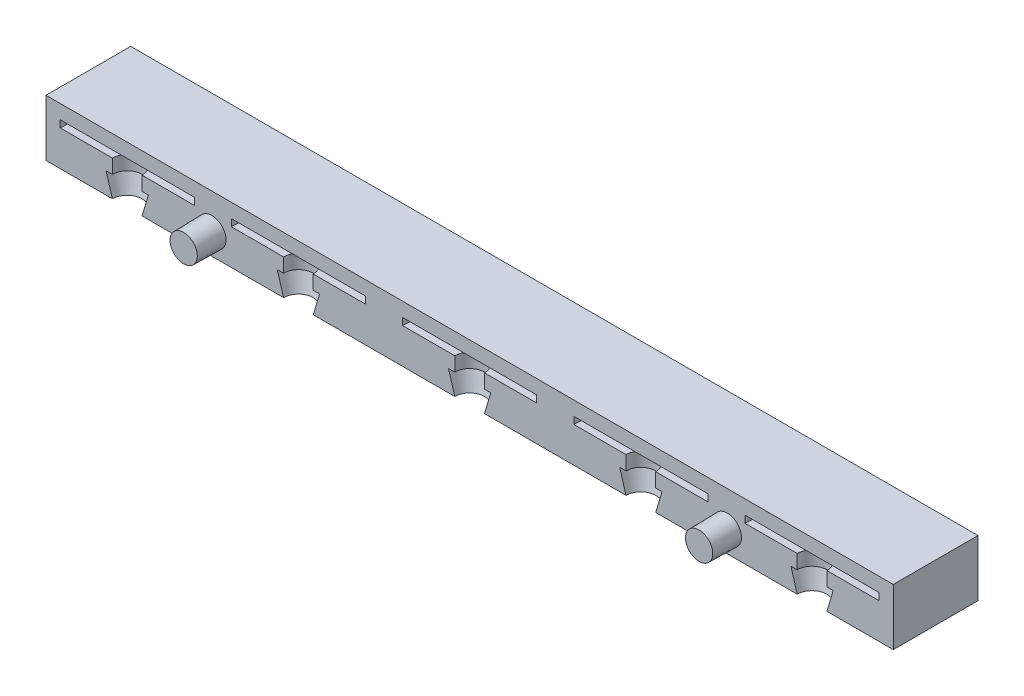
from build123d import *

# Parameters (mm, degrees)
SKETCH2_W                     = 120
SKETCH2_H                     = 8
BOSS_EXTRUDE1_DEPTH           = 12
LPATTERN1_COUNT               = 5
LPATTERN1_PITCH               = 24.25
SKETCH4_R                     = 2
BOSS_EXTRUDE2_DEPTH           = 4
BOSS_EXTRUDE2_DRAFT           = 1
BOSS_EXTRUDE2_PROFILE_2_DEPTH = 4
BOSS_EXTRUDE2_PROFILE_2_DRAFT = 1


with BuildPart() as part:
    # Sketch2 → Boss-Extrude1 (new body)
    with BuildSketch(Plane.XY):
        with Locations((60, 4)):
            Rectangle(SKETCH2_W, SKETCH2_H)
    extrude(amount=-BOSS_EXTRUDE1_DEPTH)

    # Sketch3 → Cut-Revolve1 (revolve, cut)
    with BuildSketch(Plane.XY):
        Polygon((8.5, 3), (9.4, 3), (9.4, 5), (2, 5), (2, 6), (11.5, 6), (11.5, 0), (9.4, 0), align=None)
    cut_revolve1 = revolve(axis=Axis((11.5, 6, 0), (0, -1, 0)), mode=Mode.SUBTRACT)

    # LPattern1: Cut-Revolve1 ×5
    with Locations(*[(i * LPATTERN1_PITCH, 0, 0) for i in range(1, LPATTERN1_COUNT)]):
        add(cut_revolve1, mode=Mode.SUBTRACT)


with BuildPart() as boss_extrude2_tool:
    # Sketch4 → Boss-Extrude2 (with draft: the straight prism first)
    with BuildSketch(Plane.XY):
        with Locations((23.5, 3)):
            Circle(SKETCH4_R)
    extrude(amount=BOSS_EXTRUDE2_DEPTH)
    # Boss-Extrude2: the draft: its side faces are tilted about the plane it starts from
    boss_extrude2_sides = [boss_extrude2_tool.faces().sort_by_distance(p)[0] for p in [
        (21.5, 3, 2),
    ]]
    draft(boss_extrude2_sides, Plane.XY, BOSS_EXTRUDE2_DRAFT)


with BuildPart() as part_1:
    add(part.part)

    # Boss-Extrude2: add boss_extrude2_tool
    add(boss_extrude2_tool.part)


with BuildPart() as boss_extrude2_profile_2_tool:
    # Sketch4 → Boss-Extrude2 profile 2 (with draft: the straight prism first)
    with BuildSketch(Plane.XY):
        with Locations((96.5, 3)):
            Circle(SKETCH4_R)
    extrude(amount=BOSS_EXTRUDE2_PROFILE_2_DEPTH)
    # Boss-Extrude2 profile 2: the draft: its side faces are tilted about the plane it starts from
    boss_extrude2_profile_2_sides = [boss_extrude2_profile_2_tool.faces().sort_by_distance(p)[0] for p in [
        (94.5, 3, 2),
    ]]
    draft(boss_extrude2_profile_2_sides, Plane.XY, BOSS_EXTRUDE2_PROFILE_2_DRAFT)


with BuildPart() as part_2:
    add(part_1.part)

    # Boss-Extrude2 profile 2: add boss_extrude2_profile_2_tool
    add(boss_extrude2_profile_2_tool.part)


solid = part_2.part
